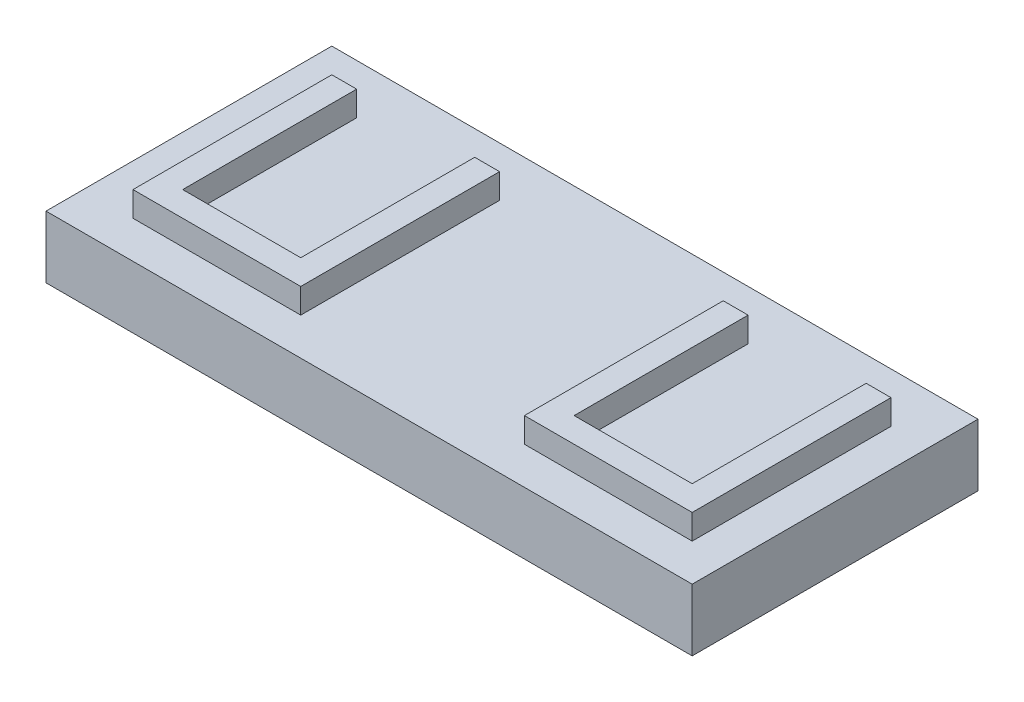
from build123d import *

# Parameters (mm, degrees)
SKETCH1_W           = 52
SKETCH1_H           = 23
BOSS_EXTRUDE1_DEPTH = 5
BOSS_EXTRUDE2_DEPTH = 2


with BuildPart() as part:
    # Sketch1 → Boss-Extrude1 (new body)
    with BuildSketch(Plane(origin=(0, 0, 0), x_dir=(1, 0, 0), z_dir=(0, 1, 0))):
        with Locations((26, 11.5)):
            Rectangle(SKETCH1_W, SKETCH1_H)
    extrude(amount=BOSS_EXTRUDE1_DEPTH)

    # Sketch2 → Boss-Extrude2 (add)
    with BuildSketch(Plane(origin=(0, 5, 0), x_dir=(1, 0, 0), z_dir=(0, 1, 0))):
        Polygon((47, 5), (37.5, 5), (37.5, 19), (35.5, 19), (35.5, 3), (49, 3), (49, 19), (47, 19), align=None)
        Polygon((4, 19), (4, 3), (17.5, 3), (17.5, 19), (15.5, 19), (15.5, 5), (6, 5), (6, 19), align=None)
    extrude(amount=BOSS_EXTRUDE2_DEPTH)


solid = part.part
